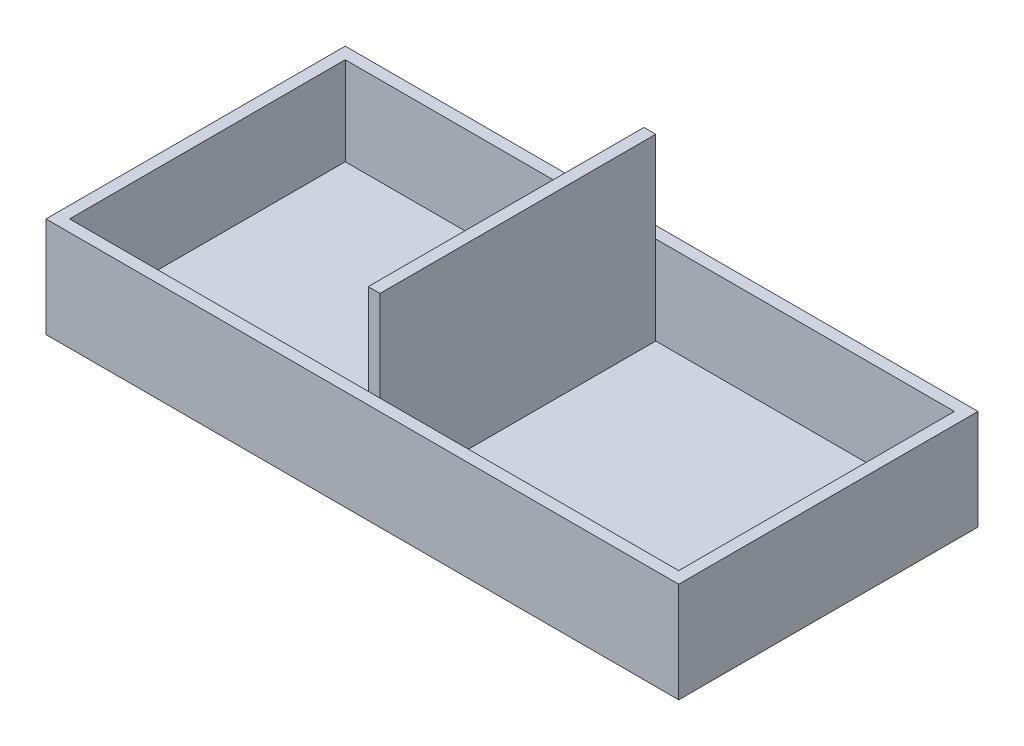
from build123d import *

# Parameters (mm, degrees)
SKETCH2_W           = 537
SKETCH2_H           = 254
BOSS_EXTRUDE1_DEPTH = 85
SKETCH3_W           = 517
SKETCH3_H           = 234
CUT_EXTRUDE1_DEPTH  = 75
SKETCH4_W           = 10
SKETCH4_H           = 234
BOSS_EXTRUDE2_DEPTH = 152


with BuildPart() as part:
    # Sketch2 → Boss-Extrude1 (new body)
    with BuildSketch(Plane(origin=(0, 0, 0), x_dir=(1, 0, 0), z_dir=(0, 1, 0))):
        with Locations((268.5, 127)):
            Rectangle(SKETCH2_W, SKETCH2_H)
    extrude(amount=BOSS_EXTRUDE1_DEPTH)

    # Sketch3 → Cut-Extrude1 (cut)
    with BuildSketch(Plane(origin=(0, 85, 0), x_dir=(1, 0, 0), z_dir=(0, 1, 0))):
        with Locations((268.5, 127)):
            Rectangle(SKETCH3_W, SKETCH3_H)
    extrude(amount=-CUT_EXTRUDE1_DEPTH, mode=Mode.SUBTRACT)

    # Sketch4 → Boss-Extrude2 (add)
    with BuildSketch(Plane(origin=(0, 10, 0), x_dir=(1, 0, 0), z_dir=(0, 1, 0))):
        with Locations((268.5, 127)):
            Rectangle(SKETCH4_W, SKETCH4_H)
    extrude(amount=BOSS_EXTRUDE2_DEPTH)


solid = part.part
